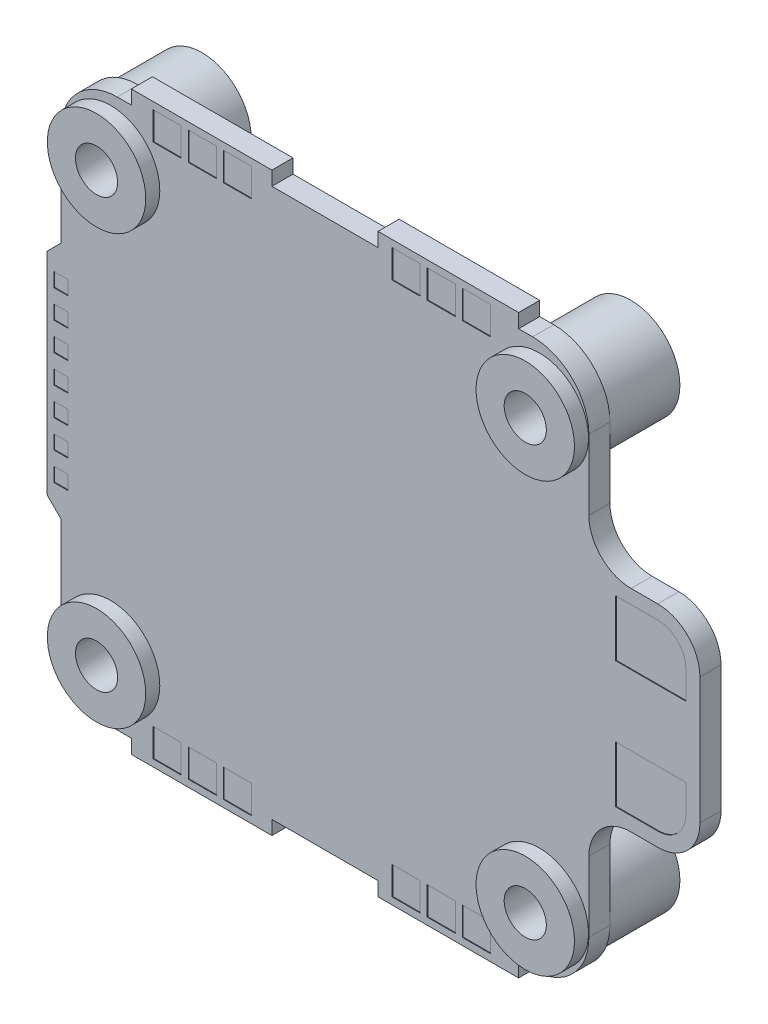
from build123d import *

# Parameters (mm, degrees)
CROQUIS1_R              = 2.5
SALIENTE_EXTRUIR1_DEPTH = 1.5
MATRIZL1_COUNT          = 2
MATRIZL1_PITCH          = 30.5
MATRIZL1_COUNT_DIR2     = 2
MATRIZL1_PITCH_DIR2     = 30.5
CROQUIS4_W              = 2
CROQUIS4_H              = 2
CROQUIS4_W_2            = 1
CROQUIS4_H_2            = 1
CORTAR_EXTRUIR1_DEPTH   = 0.05


with BuildPart() as part:
    # Croquis1 → Saliente-Extruir1 (new body)
    with BuildSketch(Plane.XY):
        with BuildLine():
            Line((-19.66677388, 13.695977011), (-19.66677388, 6.695977011))
            Line((-19.66677388, 6.695977011), (-20.66677388, 5.695977011))
            Line((-20.66677388, 5.695977011), (-20.66677388, -9.304022989))
            Line((-20.66677388, -9.304022989), (-19.66677388, -10.304022989))
            Line((-19.66677388, -10.304022989), (-19.66677388, -17.304022989))
            ThreePointArc((-19.66677388, -17.304022989), (-18.495201005, -20.132450113), (-15.66677388, -21.304022989))
            Line((-15.66677388, -21.304022989), (-14.66677388, -21.304022989))
            Line((-14.66677388, -21.304022989), (-14.66677388, -22.304022989))
            Line((-14.66677388, -22.304022989), (-4.66677388, -22.304022989))
            Line((-4.66677388, -22.304022989), (-4.66677388, -21.304022989))
            Line((-4.66677388, -21.304022989), (2.88322612, -21.304022989))
            Line((2.88322612, -21.304022989), (2.88322612, -22.304022989))
            Line((2.88322612, -22.304022989), (12.88322612, -22.304022989))
            Line((12.88322612, -22.304022989), (12.88322612, -21.304022989))
            Line((12.88322612, -21.304022989), (13.88322612, -21.304022989))
            ThreePointArc((13.88322612, -21.304022989), (16.711653245, -20.132450113), (17.88322612, -17.304022989))
            Line((17.88322612, -17.304022989), (17.88322612, -12.304022989))
            ThreePointArc((17.88322612, -12.304022989), (18.761905777, -10.182702645), (20.88322612, -9.304022989))
            Line((20.88322612, -9.304022989), (22.78322612, -9.304022989))
            ThreePointArc((22.78322612, -9.304022989), (24.904546464, -8.425343332), (25.78322612, -6.304022989))
            Line((25.78322612, -6.304022989), (25.78322612, 2.695977011))
            ThreePointArc((25.78322612, 2.695977011), (24.904546464, 4.817297355), (22.78322612, 5.695977011))
            Line((22.78322612, 5.695977011), (20.88322612, 5.695977011))
            ThreePointArc((20.88322612, 5.695977011), (18.761905777, 6.574656668), (17.88322612, 8.695977011))
            Line((17.88322612, 8.695977011), (17.88322612, 13.695977011))
            ThreePointArc((17.88322612, 13.695977011), (16.711653245, 16.524404136), (13.88322612, 17.695977011))
            Line((13.88322612, 17.695977011), (12.88322612, 17.695977011))
            Line((12.88322612, 17.695977011), (12.88322612, 18.695977011))
            Line((12.88322612, 18.695977011), (2.88322612, 18.695977011))
            Line((2.88322612, 18.695977011), (2.88322612, 17.695977011))
            Line((2.88322612, 17.695977011), (-4.66677388, 17.695977011))
            Line((-4.66677388, 17.695977011), (-4.66677388, 18.695977011))
            Line((-4.66677388, 18.695977011), (-14.66677388, 18.695977011))
            Line((-14.66677388, 18.695977011), (-14.66677388, 17.695977011))
            Line((-14.66677388, 17.695977011), (-15.66677388, 17.695977011))
            ThreePointArc((-15.66677388, 17.695977011), (-18.495201005, 16.524404136), (-19.66677388, 13.695977011))
        make_face()
        with Locations((-16.14177388, 13.445977011)):
            Circle(CROQUIS1_R, mode=Mode.SUBTRACT)
        with Locations((14.35822612, 13.445977011)):
            Circle(CROQUIS1_R, mode=Mode.SUBTRACT)
        with Locations((14.35822612, -17.054022989)):
            Circle(CROQUIS1_R, mode=Mode.SUBTRACT)
        with Locations((-16.14177388, -17.054022989)):
            Circle(CROQUIS1_R, mode=Mode.SUBTRACT)
    extrude(amount=SALIENTE_EXTRUIR1_DEPTH)

    # Croquis3 → Revolución1 (revolve)
    with BuildSketch(Plane(origin=(0, -17.054022989, 0), x_dir=(-1, 0, 0), z_dir=(0, -1, 0)), mode=Mode.PRIVATE) as revoluci_n1_sk:
        Polygon((18.64177388, -1.5), (19.64177388, -1.5), (19.64177388, -2.5), (17.64177388, -2.5), (17.64177388, 5), (19.64177388, 5), (19.64177388, 0), (18.64177388, 0), align=None)
    revoluci_n1 = revolve(revoluci_n1_sk.sketch.rotate(Axis((-16.14177388, -17.054022989, 2.5), (0, 0, -1)), 180), axis=Axis((-16.14177388, -17.054022989, 2.5), (0, 0, -1)))

    # MatrizL1: Revoluci_n1 2 × 2
    with Locations(*[(i * MATRIZL1_PITCH, j * MATRIZL1_PITCH_DIR2, 0) for i in range(MATRIZL1_COUNT) for j in range(MATRIZL1_COUNT_DIR2) if (i, j) != (0, 0)]):
        add(revoluci_n1)

    # Croquis4 → Cortar-Extruir1 (cut)
    with BuildSketch(Plane.XY.offset(1.5)):
        with BuildLine():
            Line((19.78322612, -8.304022989), (22.78322612, -8.304022989))
            ThreePointArc((22.78322612, -8.304022989), (24.197439683, -7.718236551), (24.78322612, -6.304022989))
            Line((24.78322612, -6.304022989), (24.78322612, -4.304022989))
            Line((24.78322612, -4.304022989), (19.78322612, -4.304022989))
            Line((19.78322612, -4.304022989), (19.78322612, -8.304022989))
        make_face()
        with Locations((9.88322612, -20.804022989)):
            Rectangle(CROQUIS4_W, CROQUIS4_H)
        with Locations((-19.66677388, -7.804022989)):
            Rectangle(CROQUIS4_W_2, CROQUIS4_H_2)
        with Locations((7.38322612, -20.804022989)):
            Rectangle(CROQUIS4_W, CROQUIS4_H)
        with Locations((4.88322612, -20.804022989)):
            Rectangle(CROQUIS4_W, CROQUIS4_H)
        with Locations((-7.11677388, -20.804022989)):
            Rectangle(CROQUIS4_W, CROQUIS4_H)
        with Locations((-9.61677388, -20.804022989)):
            Rectangle(CROQUIS4_W, CROQUIS4_H)
        with Locations((-12.11677388, -20.804022989)):
            Rectangle(CROQUIS4_W, CROQUIS4_H)
        with Locations((-19.66677388, -5.804022989)):
            Rectangle(CROQUIS4_W_2, CROQUIS4_H_2)
        with Locations((-19.66677388, -3.804022989)):
            Rectangle(CROQUIS4_W_2, CROQUIS4_H_2)
        with Locations((-19.66677388, -1.804022989)):
            Rectangle(CROQUIS4_W_2, CROQUIS4_H_2)
        with Locations((-19.66677388, 0.195977011)):
            Rectangle(CROQUIS4_W_2, CROQUIS4_H_2)
        with Locations((-19.66677388, 2.195977011)):
            Rectangle(CROQUIS4_W_2, CROQUIS4_H_2)
        with Locations((-19.66677388, 4.195977011)):
            Rectangle(CROQUIS4_W_2, CROQUIS4_H_2)
        with Locations((-12.11677388, 17.195977011)):
            Rectangle(CROQUIS4_W, CROQUIS4_H)
        with Locations((-9.61677388, 17.195977011)):
            Rectangle(CROQUIS4_W, CROQUIS4_H)
        with Locations((-7.11677388, 17.195977011)):
            Rectangle(CROQUIS4_W, CROQUIS4_H)
        with Locations((4.88322612, 17.195977011)):
            Rectangle(CROQUIS4_W, CROQUIS4_H)
        with Locations((7.38322612, 17.195977011)):
            Rectangle(CROQUIS4_W, CROQUIS4_H)
        with Locations((9.88322612, 17.195977011)):
            Rectangle(CROQUIS4_W, CROQUIS4_H)
        with BuildLine():
            Line((24.78322612, 2.695977011), (24.78322612, 0.695977011))
            Line((24.78322612, 0.695977011), (19.78322612, 0.695977011))
            Line((19.78322612, 0.695977011), (19.78322612, 4.695977011))
            Line((19.78322612, 4.695977011), (22.78322612, 4.695977011))
            ThreePointArc((22.78322612, 4.695977011), (24.197439683, 4.110190574), (24.78322612, 2.695977011))
        make_face()
    extrude(amount=-CORTAR_EXTRUIR1_DEPTH, mode=Mode.SUBTRACT)


solid = part.part
